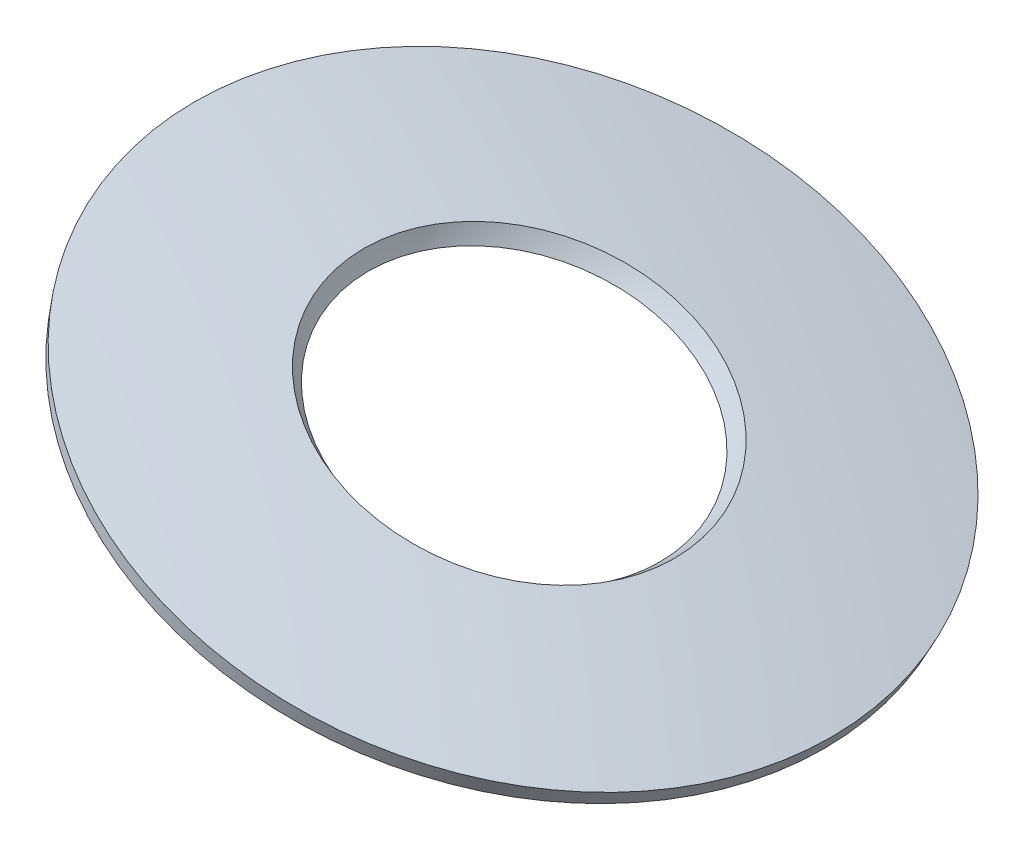
from build123d import *


with BuildPart() as part:
    # sketch1 → Revolve2 (revolve)
    with BuildSketch(Plane.XY):
        with BuildLine():
            Line((116.622604591, 219.335218911), (117.367890696, 220.736898215))
            ThreePointArc((117.367890696, 220.736898215), (109.383378958, 224.800525817), (101.258391839, 228.575453805))
            ThreePointArc((101.258391839, 228.575453805), (100.517824968, 228.022476969), (99.752501468, 227.50430459))
            ThreePointArc((99.752501468, 227.50430459), (108.264630054, 223.578934686), (116.622604591, 219.335218911))
        make_face()
    revolve(axis=Axis((0, 0, 0), (0.34202014332567315, 0.9396926207859068, 0)))


solid = part.part
